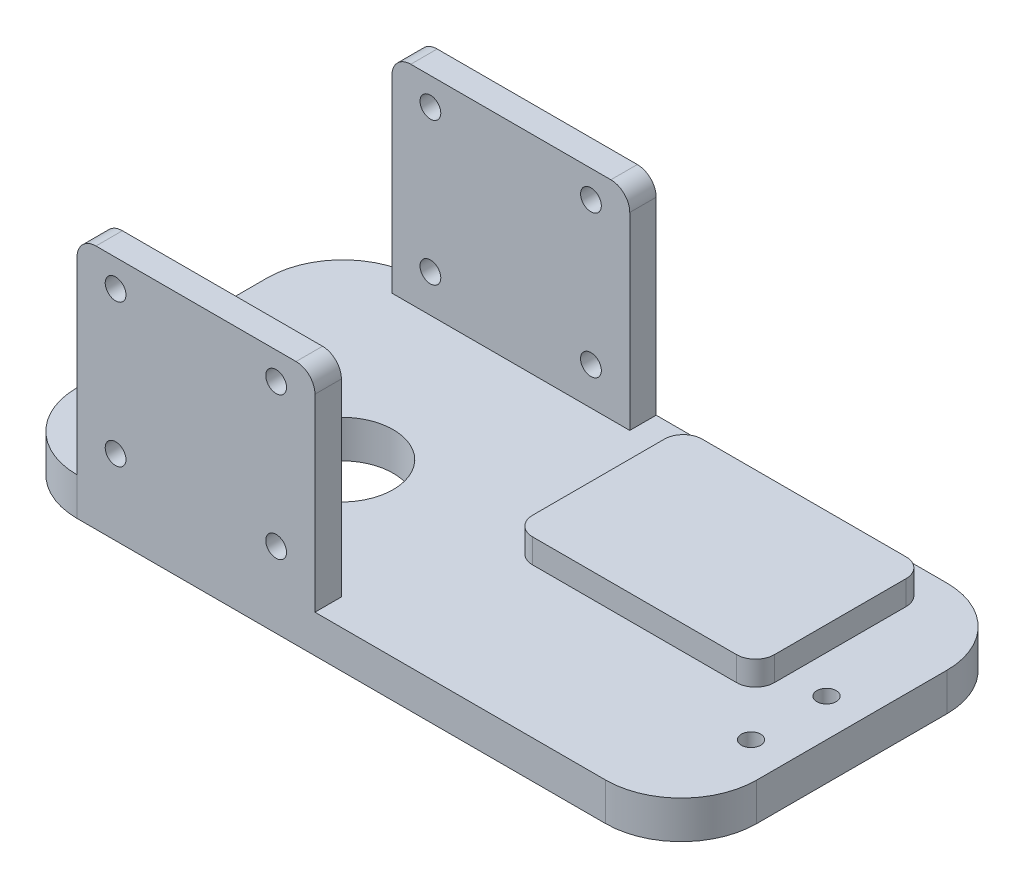
from build123d import *

# Parameters (mm, degrees)
SKETCH1_W           = 228.6
SKETCH1_H           = 114.78
BOSS_EXTRUDE1_DEPTH = 12.7
SKETCH2_W           = 80.01
SKETCH2_H           = 8.89
BOSS_EXTRUDE2_DEPTH = 69.85
SKETCH3_W           = 81.28
SKETCH3_H           = 57
BOSS_EXTRUDE3_DEPTH = 8.159375
SKETCH4_R           = 17.4625
CUT_EXTRUDE1_DEPTH  = 146.729628422
SKETCH5_R           = 3.4925
CUT_EXTRUDE2_DEPTH  = 182.80605298
SKETCH6_R           = 17.4625
SKETCH6_R_2         = 3.25
CUT_EXTRUDE3_DEPTH  = 146.729628422
FILLET1_R           = 25.4
FILLET2_R           = 6.35
FILLET3_R           = 6.35


with BuildPart() as part:
    # Sketch1 → Boss-Extrude1 (new body)
    with BuildSketch(Plane(origin=(0, 0, 0), x_dir=(1, 0, 0), z_dir=(0, 1, 0))):
        Rectangle(SKETCH1_W, SKETCH1_H)
    extrude(amount=BOSS_EXTRUDE1_DEPTH)

    # Sketch2 → Boss-Extrude2 (add)
    with BuildSketch(Plane(origin=(0, 12.7, 0), x_dir=(1, 0, 0), z_dir=(0, 1, 0))):
        with Locations((-48.895, 52.945)):
            Rectangle(SKETCH2_W, SKETCH2_H)
        with Locations((-48.895, -52.945)):
            Rectangle(SKETCH2_W, SKETCH2_H)
    extrude(amount=BOSS_EXTRUDE2_DEPTH)

    # Sketch3 → Boss-Extrude3 (add)
    with BuildSketch(Plane(origin=(0, 12.7, 0), x_dir=(1, 0, 0), z_dir=(0, 1, 0))):
        with Locations((48.26, 21.5)):
            Rectangle(SKETCH3_W, SKETCH3_H)
    extrude(amount=BOSS_EXTRUDE3_DEPTH)

    # Sketch4 → Cut-Extrude1 (cut, through all)
    with BuildSketch(Plane(origin=(0, 12.7, 0), x_dir=(1, 0, 0), z_dir=(0, 1, 0))):
        with Locations(Location((-48.9, -8.5, 0), (0, 0, 270))):
            Circle(SKETCH4_R)
    extrude(amount=-CUT_EXTRUDE1_DEPTH, mode=Mode.SUBTRACT)

    # Sketch5 → Cut-Extrude2 (cut, through all)
    with BuildSketch(Plane.XY.offset(57.39)):
        with Locations((-75.946, 73.359375)):
            Circle(SKETCH5_R)
        with Locations((-21.946, 73.359375)):
            Circle(SKETCH5_R)
        with Locations((-75.946, 25.359375)):
            Circle(SKETCH5_R)
        with Locations((-21.946, 25.359375)):
            Circle(SKETCH5_R)
    extrude(amount=-CUT_EXTRUDE2_DEPTH, mode=Mode.SUBTRACT)

    # Sketch6 → Cut-Extrude3 (cut, through all)
    with BuildSketch(Plane(origin=(0, 12.7, 0), x_dir=(1, 0, 0), z_dir=(0, 1, 0))):
        with Locations(Location((-48.9, -8.5, 0), (0, 0, 270))):
            Circle(SKETCH6_R)
        with Locations(Location((-101.6, -21.2, 0), (0, 0, 270))):
            Circle(SKETCH6_R_2)
        with Locations(Location((-101.6, 4.2, 0), (0, 0, 270))):
            Circle(SKETCH6_R_2)
        with Locations(Location((101.6, -21.2, 0), (0, 0, 270))):
            Circle(SKETCH6_R_2)
        with Locations(Location((101.6, 4.2, 0), (0, 0, 270))):
            Circle(SKETCH6_R_2)
    extrude(amount=-CUT_EXTRUDE3_DEPTH, mode=Mode.SUBTRACT)

    # Fillet1
    fillet1_edges = [part.edges().sort_by_distance(p)[0] for p in [
        (114.3, 6.35, 57.39),
        (-114.3, 6.35, 57.39),
        (-114.3, 6.35, -57.39),
        (114.3, 6.35, -57.39),
    ]]
    fillet(fillet1_edges, radius=FILLET1_R)

    # Fillet2
    fillet2_edges = [part.edges().sort_by_distance(p)[0] for p in [
        (-88.9, 82.55, -52.945),
        (-8.89, 82.55, -52.945),
        (-88.9, 82.55, 52.945),
        (-8.89, 82.55, 52.945),
    ]]
    fillet(fillet2_edges, radius=FILLET2_R)

    # Fillet3
    fillet3_edges = [part.edges().sort_by_distance(p)[0] for p in [
        (88.9, 16.7796875, 7),
        (88.9, 16.7796875, -50),
        (7.62, 16.7796875, -50),
        (7.62, 16.7796875, 7),
    ]]
    fillet(fillet3_edges, radius=FILLET3_R)


solid = part.part
